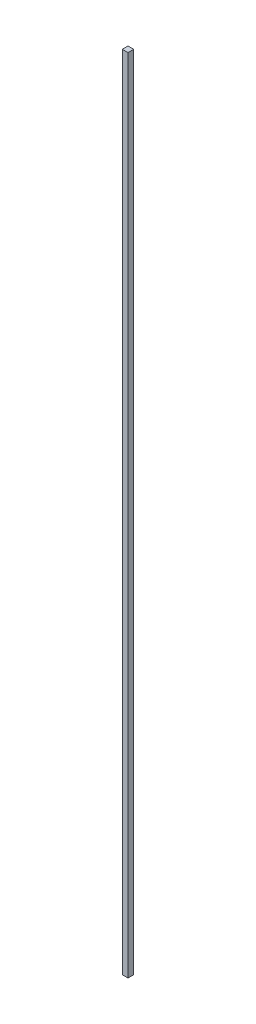
from build123d import *

# Parameters (mm, degrees)
SKETCH2_W           = 0.5
SKETCH2_H           = 0.5
BOSS_EXTRUDE2_DEPTH = 70


with BuildPart() as part:
    # Sketch2 → Boss-Extrude2 (new body)
    with BuildSketch(Plane(origin=(0, 0, 0), x_dir=(1, 0, 0), z_dir=(0, 1, 0))):
        Rectangle(SKETCH2_W, SKETCH2_H)
    extrude(amount=BOSS_EXTRUDE2_DEPTH)


solid = part.part
